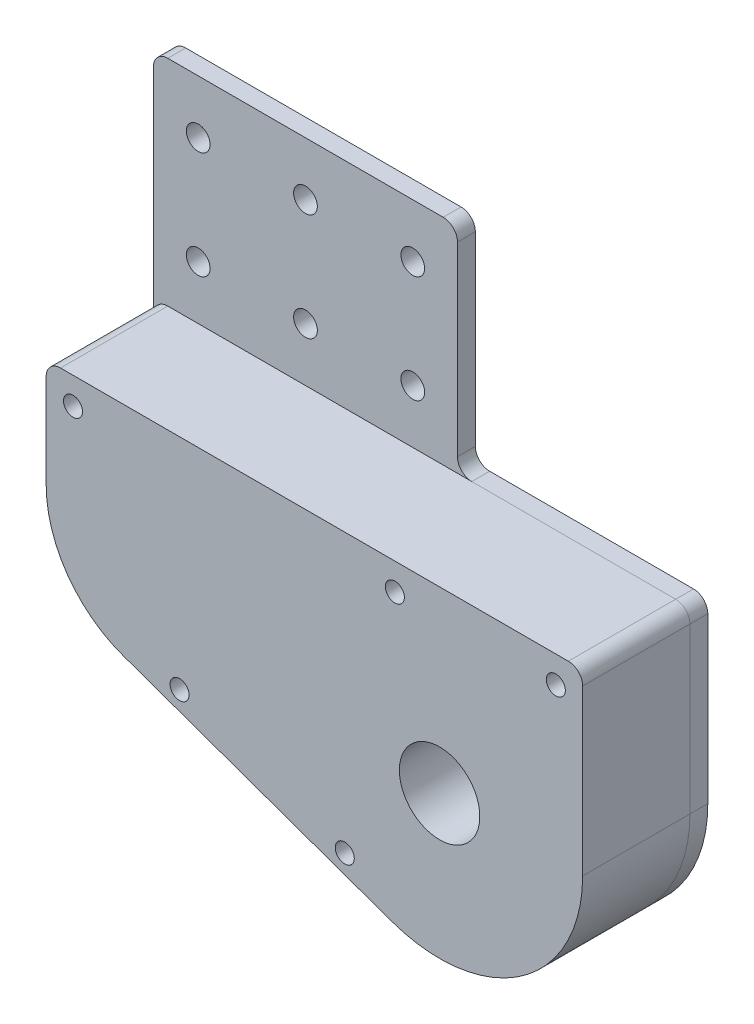
from build123d import *

# Parameters (mm, degrees)
BOSS_EXTRUDE1_DEPTH         = 6.35
SKETCH3_W                   = 107.95
SKETCH3_H                   = 76.2
BOSS_EXTRUDE2_DEPTH         = 6.35
FILLET1_R                   = 5.08
CUT_EXTRUDE1_REACH          = 199.668
SKETCH4_R                   = 14.2875
TAP_DRILL_FOR_1_4_20_TAP1_D = 5.1054
F_5_16_CLEARANCE_HOLE1_D    = 8.4328
SKETCH15_R                  = 14.2875
BOSS_EXTRUDE3_DEPTH         = 38.1
SKETCH16_R                  = 3.3782
CUT_EXTRUDE3_DEPTH          = 38.1


with BuildPart() as part:
    # Sketch2 → Boss-Extrude1 (new body)
    with BuildSketch(Plane.XY):
        with BuildLine():
            Line((50.8, 63.5), (-139.7, 63.5))
            Line((-139.7, 63.5), (-139.7, 24.9428))
            ThreePointArc((-139.7, 24.9428), (-132.170466199, 1.196645543), (-112.333373337, -13.871980059))
            Line((-112.333373337, -13.871980059), (-17.064303956, -47.848192552))
            ThreePointArc((-17.064303956, -47.848192552), (29.272626795, -41.518108344), (50.8, 0))
            Line((50.8, 0), (50.8, 63.5))
        make_face()
    extrude(amount=-BOSS_EXTRUDE1_DEPTH)

    # Sketch3 → Boss-Extrude2 (add)
    with BuildSketch(Plane.XY):
        with Locations((-85.725, 101.6)):
            Rectangle(SKETCH3_W, SKETCH3_H)
    extrude(amount=-BOSS_EXTRUDE2_DEPTH)

    # Fillet1
    fillet1_edges = [part.edges().sort_by_distance(p)[0] for p in [
        (50.8, 63.5, -3.175),
        (-31.75, 139.7, -3.175),
        (-139.7, 139.7, -3.175),
        (-31.75, 63.5, -3.175),
    ]]
    fillet(fillet1_edges, radius=FILLET1_R)

    # Sketch4 → Cut-Extrude1 (cut, up to next)
    with BuildSketch(Plane.XY, mode=Mode.PRIVATE) as cut_extrude1_sk1:
        Circle(SKETCH4_R)
    cut_extrude1_tool1 = extrude(cut_extrude1_sk1.sketch, amount=-CUT_EXTRUDE1_REACH, mode=Mode.PRIVATE) & part.part
    add(cut_extrude1_tool1.solids().sort_by_distance((0, 0, 0))[0], mode=Mode.SUBTRACT)

    # Tap Drill for 1/4-20 Tap1 (through all)
    with Locations(Plane.XY):
        with Locations((-33.671992271, -35.183583732), (-92.344956452, -14.258795534), (-130.175, 53.975), (-15.875, 53.975), (41.275, 53.975)):
            Hole(TAP_DRILL_FOR_1_4_20_TAP1_D / 2)

    # 5/16 Clearance Hole1 (through all)
    with Locations(Plane.XY):
        with Locations((-123.825, 120.65), (-85.725, 120.65), (-47.625, 120.65), (-47.625, 82.55), (-85.725, 82.55), (-123.825, 82.55)):
            Hole(F_5_16_CLEARANCE_HOLE1_D / 2)


with BuildPart() as body_2:
    # Sketch15 → Boss-Extrude3 (new body)
    with BuildSketch(Plane.XY):
        with BuildLine():
            Line((-112.333373337, -13.871980059), (-17.064303956, -47.848192552))
            ThreePointArc((-17.064303956, -47.848192552), (29.272626795, -41.518108344), (50.8, 0))
            Line((50.8, 0), (50.8, 58.42))
            ThreePointArc((50.8, 58.42), (49.312102448, 62.012102448), (45.72, 63.5))
            Line((45.72, 63.5), (-134.62, 63.5))
            ThreePointArc((-134.62, 63.5), (-138.212102448, 62.012102448), (-139.7, 58.42))
            Line((-139.7, 58.42), (-139.7, 24.9428))
            ThreePointArc((-139.7, 24.9428), (-132.170466199, 1.196645543), (-112.333373337, -13.871980059))
        make_face()
        with Locations(Location((0, 0, 0), (0, 0, 180))):
            Circle(SKETCH15_R, mode=Mode.SUBTRACT)
    extrude(amount=BOSS_EXTRUDE3_DEPTH)

    # Sketch16 → Cut-Extrude3 (cut)
    with BuildSketch(Plane.XY.offset(38.1)):
        with Locations((-15.875, 53.975)):
            Circle(SKETCH16_R)
        with Locations((-92.344956452, -14.258795534)):
            Circle(SKETCH16_R)
        with Locations((-33.671992271, -35.183583732)):
            Circle(SKETCH16_R)
        with Locations((41.275, 53.975)):
            Circle(SKETCH16_R)
        with Locations((-130.175, 53.975)):
            Circle(SKETCH16_R)
    extrude(amount=-CUT_EXTRUDE3_DEPTH, mode=Mode.SUBTRACT)


solid = Compound([part.part, body_2.part])
